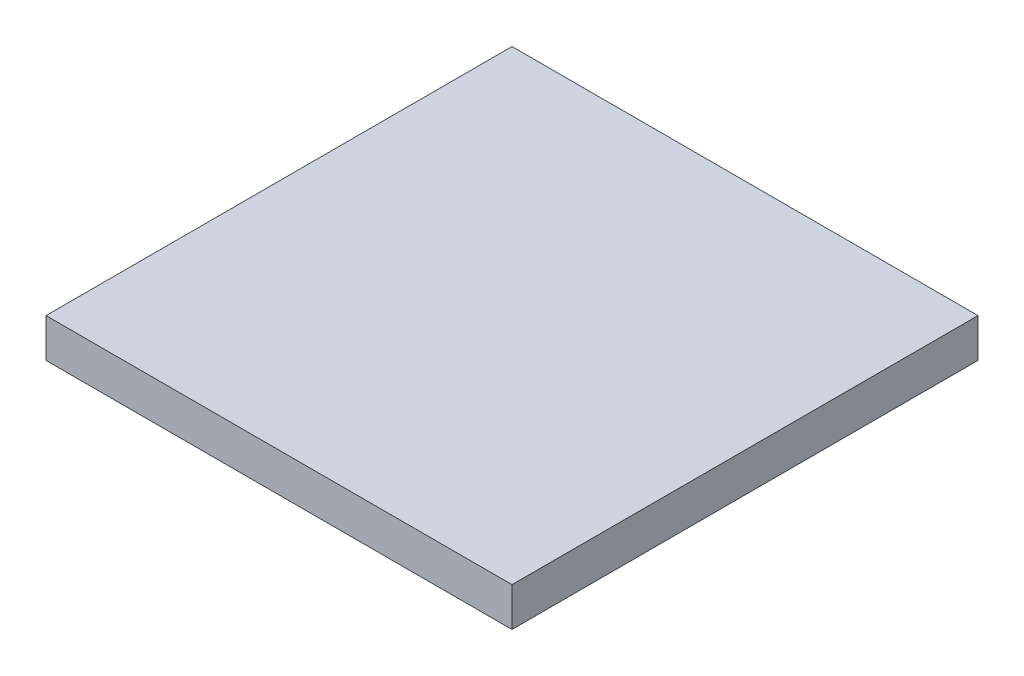
from build123d import *

# Parameters (mm, degrees)
SKETCH1_W           = 60
SKETCH1_H           = 60
BOSS_EXTRUDE1_DEPTH = 5


with BuildPart() as part:
    # Sketch1 → Boss-Extrude1 (new body)
    with BuildSketch(Plane(origin=(0, 0, 0), x_dir=(1, 0, 0), z_dir=(0, 1, 0))):
        with Locations((30, 30)):
            Rectangle(SKETCH1_W, SKETCH1_H)
    extrude(amount=BOSS_EXTRUDE1_DEPTH)


solid = part.part
